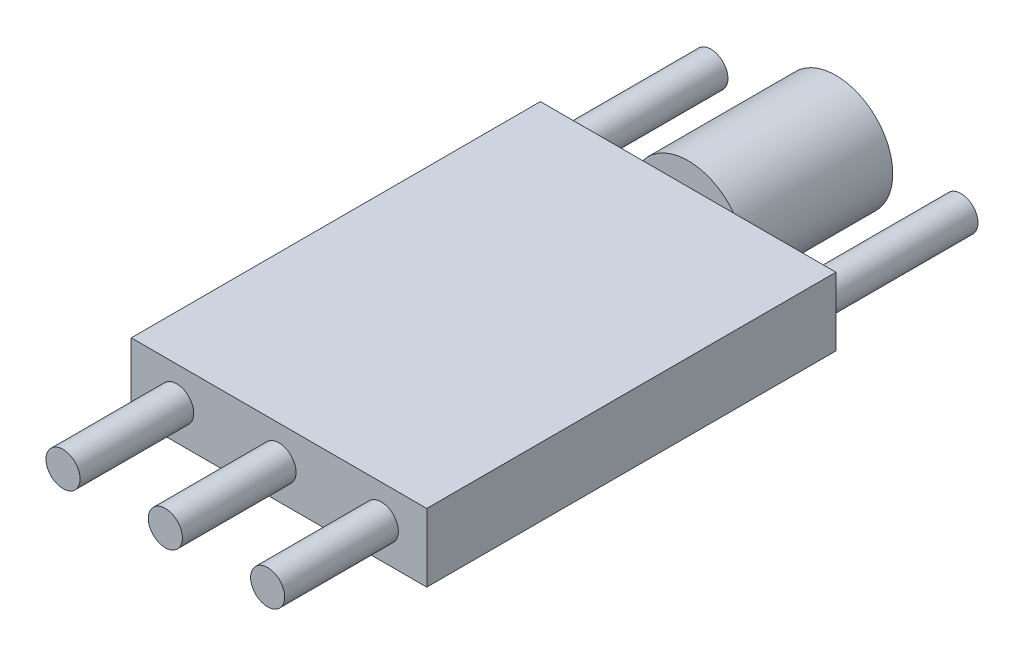
from build123d import *

# Parameters (mm, degrees)
SKETCH1_W           = 26
SKETCH1_H           = 36
BOSS_EXTRUDE1_DEPTH = 6
SKETCH2_R           = 1.5
BOSS_EXTRUDE2_DEPTH = 10
SKETCH3_R           = 5
SKETCH3_R_2         = 1.5
BOSS_EXTRUDE3_DEPTH = 13


with BuildPart() as part:
    # Sketch1 → Boss-Extrude1 (new body)
    with BuildSketch(Plane(origin=(0, 0, 0), x_dir=(1, 0, 0), z_dir=(0, 1, 0))):
        Rectangle(SKETCH1_W, SKETCH1_H)
    extrude(amount=BOSS_EXTRUDE1_DEPTH)

    # Sketch2 → Boss-Extrude2 (add)
    with BuildSketch(Plane.XY.offset(18)):
        with Locations(Location((0, 3, 0), (0, 0, 180))):
            Circle(SKETCH2_R)
        with Locations(Location((-9, 3, 0), (0, 0, 180))):
            Circle(SKETCH2_R)
        with Locations(Location((9, 3, 0), (0, 0, 180))):
            Circle(SKETCH2_R)
    extrude(amount=BOSS_EXTRUDE2_DEPTH)

    # Sketch3 → Boss-Extrude3 (add)
    with BuildSketch(Plane(origin=(0, 0, -18), x_dir=(-1, 0, 0), z_dir=(0, 0, -1))):
        with Locations(Location((0, 3, 0), (0, 0, 143.130102354))):
            Circle(SKETCH3_R)
        with Locations(Location((-11, 3, 0), (0, 0, 180))):
            Circle(SKETCH3_R_2)
        with Locations(Location((11, 3, 0), (0, 0, 180))):
            Circle(SKETCH3_R_2)
    extrude(amount=BOSS_EXTRUDE3_DEPTH)


solid = part.part
